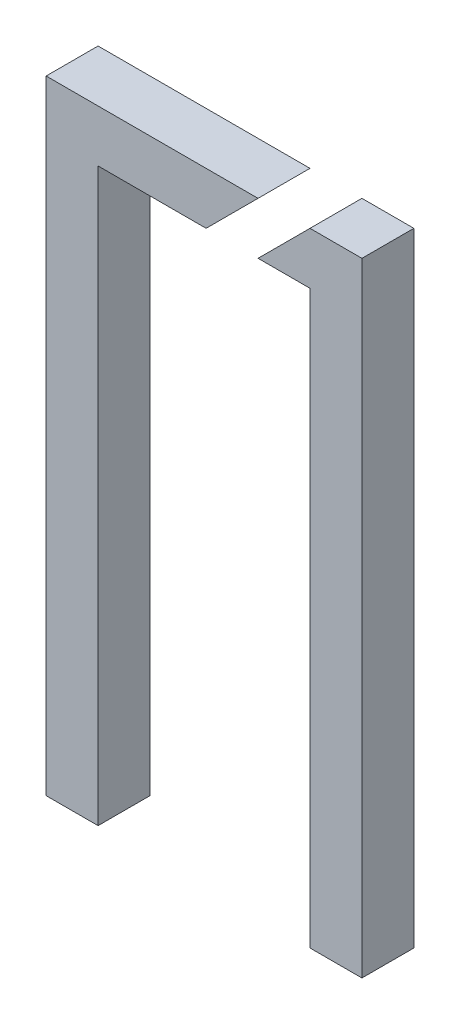
from build123d import *

# Parameters (mm, degrees)
BOSS_EXTRUDE1_DEPTH   = 0.5
BOSS_EXTRUDE1_2_DEPTH = 0.5


with BuildPart() as part:
    # Sketch1 → Boss-Extrude1 (new body)
    with BuildSketch(Plane.XY):
        Polygon((0, 6), (0, 0), (0.5, 0), (0.5, 5.5), (1.54, 5.5), (2.04, 6), align=None)
    extrude(amount=BOSS_EXTRUDE1_DEPTH)


with BuildPart() as body_2:
    # Sketch1 → Boss-Extrude1 2 (new body)
    with BuildSketch(Plane.XY):
        Polygon((2.54, 6), (3.04, 6), (3.04, 0), (2.54, 0), (2.54, 5.5), (2.04, 5.5), align=None)
    extrude(amount=BOSS_EXTRUDE1_2_DEPTH)


solid = Compound([part.part, body_2.part])
